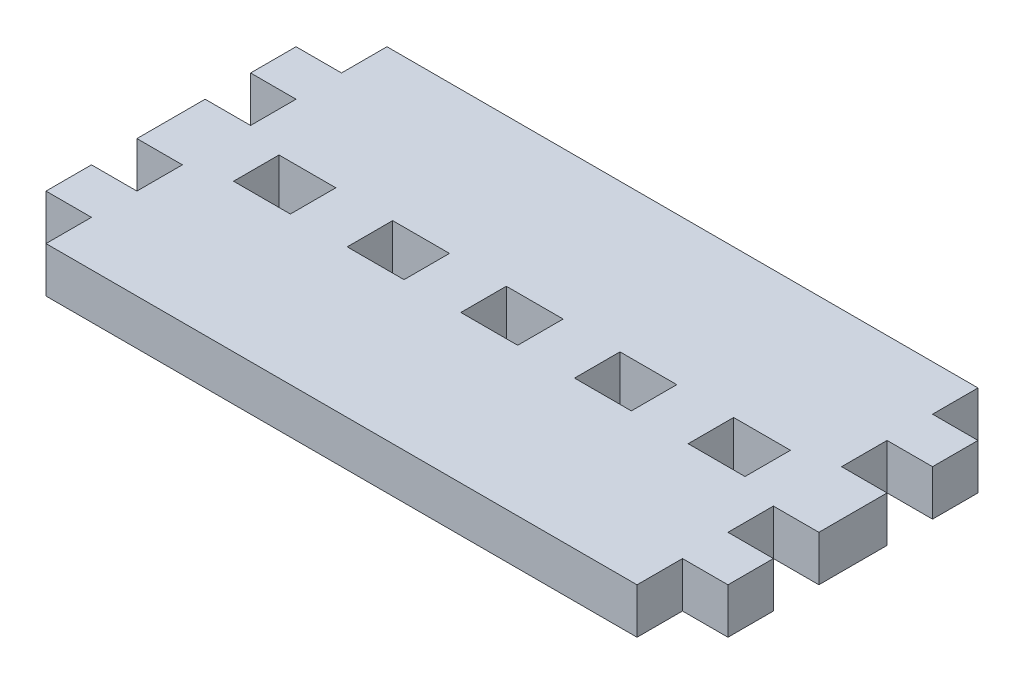
from build123d import *

# Parameters (mm, degrees)
SKETCH1_W           = 76.2
SKETCH1_H           = 38.1
BOSS_EXTRUDE1_DEPTH = 5.08
SKETCH2_W           = 5.08
SKETCH2_H           = 5.08
CUT_EXTRUDE1_DEPTH  = 5.08
SKETCH3_W           = 6.35
SKETCH3_H           = 5.08
CUT_EXTRUDE2_DEPTH  = 5.08


with BuildPart() as part:
    # Sketch1 → Boss-Extrude1 (new body)
    with BuildSketch(Plane(origin=(0, 0, 0), x_dir=(1, 0, 0), z_dir=(0, 1, 0))):
        with Locations((12.573, 1.2065)):
            Rectangle(SKETCH1_W, SKETCH1_H)
    extrude(amount=BOSS_EXTRUDE1_DEPTH)

    # Sketch2 → Cut-Extrude1 (cut)
    with BuildSketch(Plane(origin=(0, 5.08, 0), x_dir=(1, 0, 0), z_dir=(0, 1, 0))):
        with Locations((-22.987, -5.1435)):
            Rectangle(SKETCH2_W, SKETCH2_H)
        with Locations((48.133, 17.7165)):
            Rectangle(SKETCH2_W, SKETCH2_H)
        with Locations((48.133, 7.5565)):
            Rectangle(SKETCH2_W, SKETCH2_H)
        with Locations((48.133, -15.3035)):
            Rectangle(SKETCH2_W, SKETCH2_H)
        with Locations((48.133, -5.1435)):
            Rectangle(SKETCH2_W, SKETCH2_H)
        with Locations((-22.987, -15.3035)):
            Rectangle(SKETCH2_W, SKETCH2_H)
        with Locations((-22.987, 7.5565)):
            Rectangle(SKETCH2_W, SKETCH2_H)
        with Locations((-22.987, 17.7165)):
            Rectangle(SKETCH2_W, SKETCH2_H)
    extrude(amount=-CUT_EXTRUDE1_DEPTH, mode=Mode.SUBTRACT)

    # Sketch3 → Cut-Extrude2 (cut)
    with BuildSketch(Plane(origin=(0, 5.08, 0), x_dir=(1, 0, 0), z_dir=(0, 1, 0))):
        with Locations((-12.827, 1.2065)):
            Rectangle(SKETCH3_W, SKETCH3_H)
        with Locations((12.573, 1.2065)):
            Rectangle(SKETCH3_W, SKETCH3_H)
        with Locations((25.273, 1.2065)):
            Rectangle(SKETCH3_W, SKETCH3_H)
        with Locations((37.973, 1.2065)):
            Rectangle(SKETCH3_W, SKETCH3_H)
        with Locations((-0.127, 1.2065)):
            Rectangle(SKETCH3_W, SKETCH3_H)
    extrude(amount=-CUT_EXTRUDE2_DEPTH, mode=Mode.SUBTRACT)


solid = part.part
